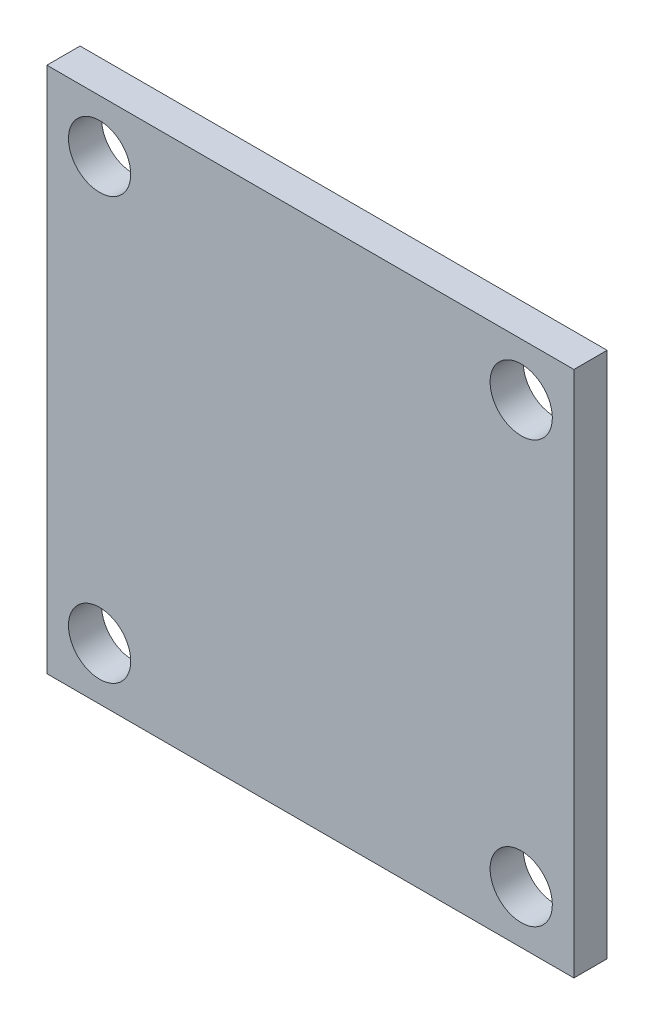
from build123d import *

# Parameters (mm, degrees)
SKETCH1_W           = 25.4
SKETCH1_H           = 25.4
SKETCH1_R           = 1.5
BOSS_EXTRUDE1_DEPTH = 1.6


with BuildPart() as part:
    # Sketch1 → Boss-Extrude1 (new body)
    with BuildSketch(Plane.XY):
        Rectangle(SKETCH1_W, SKETCH1_H)
        with Locations((-10.16, 10.16)):
            Circle(SKETCH1_R, mode=Mode.SUBTRACT)
        with Locations((10.16, 10.16)):
            Circle(SKETCH1_R, mode=Mode.SUBTRACT)
        with Locations((10.16, -10.16)):
            Circle(SKETCH1_R, mode=Mode.SUBTRACT)
        with Locations((-10.16, -10.16)):
            Circle(SKETCH1_R, mode=Mode.SUBTRACT)
    extrude(amount=BOSS_EXTRUDE1_DEPTH)


solid = part.part
